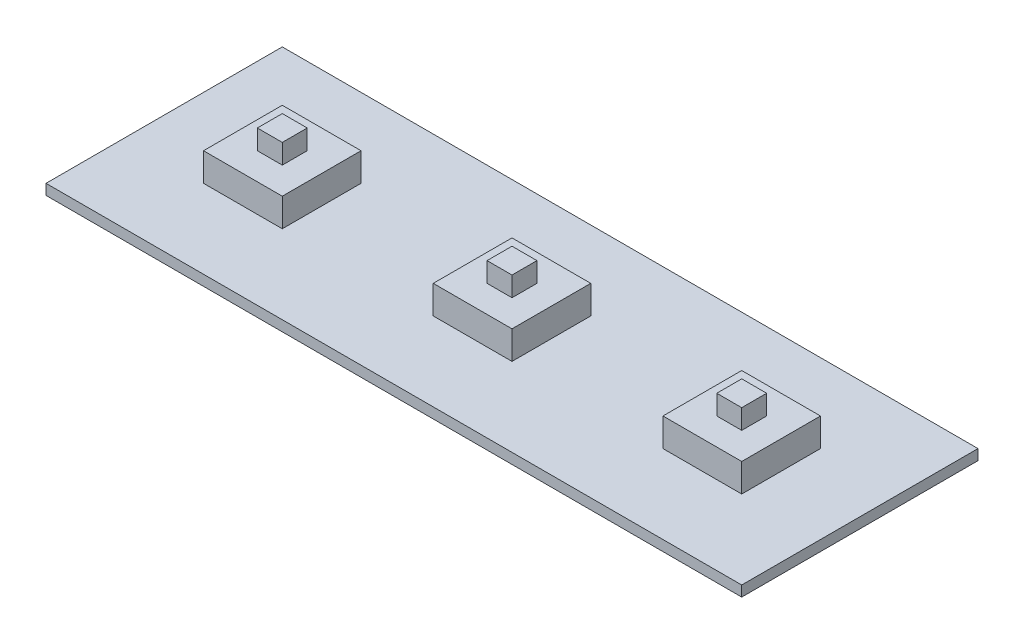
from build123d import *

# Parameters (mm, degrees)
SKETCH1_W           = 12
SKETCH1_H           = 12
BOSS_EXTRUDE1_DEPTH = 4.3
SKETCH2_W           = 3.8
SKETCH2_H           = 3.8
BOSS_EXTRUDE2_DEPTH = 3
SKETCH3_W           = 106
SKETCH3_H           = 36
BOSS_EXTRUDE3_DEPTH = 1.6
SKETCH4_W           = 12
SKETCH4_H           = 12
BOSS_EXTRUDE4_DEPTH = 4.3
SKETCH5_W           = 3.8
SKETCH5_H           = 3.8
BOSS_EXTRUDE5_DEPTH = 3


with BuildPart() as part:
    # Sketch1 → Boss-Extrude1 (new body)
    with BuildSketch(Plane(origin=(0, 0, 0), x_dir=(1, 0, 0), z_dir=(0, 1, 0))):
        with Locations((6, 6)):
            Rectangle(SKETCH1_W, SKETCH1_H)
    extrude(amount=BOSS_EXTRUDE1_DEPTH)

    # Sketch2 → Boss-Extrude2 (add)
    with BuildSketch(Plane(origin=(0, 4.3, 0), x_dir=(1, 0, 0), z_dir=(0, 1, 0))):
        with Locations((6, 6)):
            Rectangle(SKETCH2_W, SKETCH2_H)
    extrude(amount=BOSS_EXTRUDE2_DEPTH)

    # Sketch3 → Boss-Extrude3 (add)
    with BuildSketch(Plane.XZ):
        with Locations((41, -6)):
            Rectangle(SKETCH3_W, SKETCH3_H)
    extrude(amount=BOSS_EXTRUDE3_DEPTH)

    # Sketch4 → Boss-Extrude4 (add)
    with BuildSketch(Plane(origin=(0, 0, 0), x_dir=(1, 0, 0), z_dir=(0, 1, 0))):
        with Locations((41, 6)):
            Rectangle(SKETCH4_W, SKETCH4_H)
        with Locations((76, 6)):
            Rectangle(SKETCH4_W, SKETCH4_H)
    extrude(amount=BOSS_EXTRUDE4_DEPTH)

    # Sketch5 → Boss-Extrude5 (add)
    with BuildSketch(Plane(origin=(0, 4.3, 0), x_dir=(1, 0, 0), z_dir=(0, 1, 0))):
        with Locations((41, 6)):
            Rectangle(SKETCH5_W, SKETCH5_H)
        with Locations((76, 6)):
            Rectangle(SKETCH5_W, SKETCH5_H)
    extrude(amount=BOSS_EXTRUDE5_DEPTH)


solid = part.part
